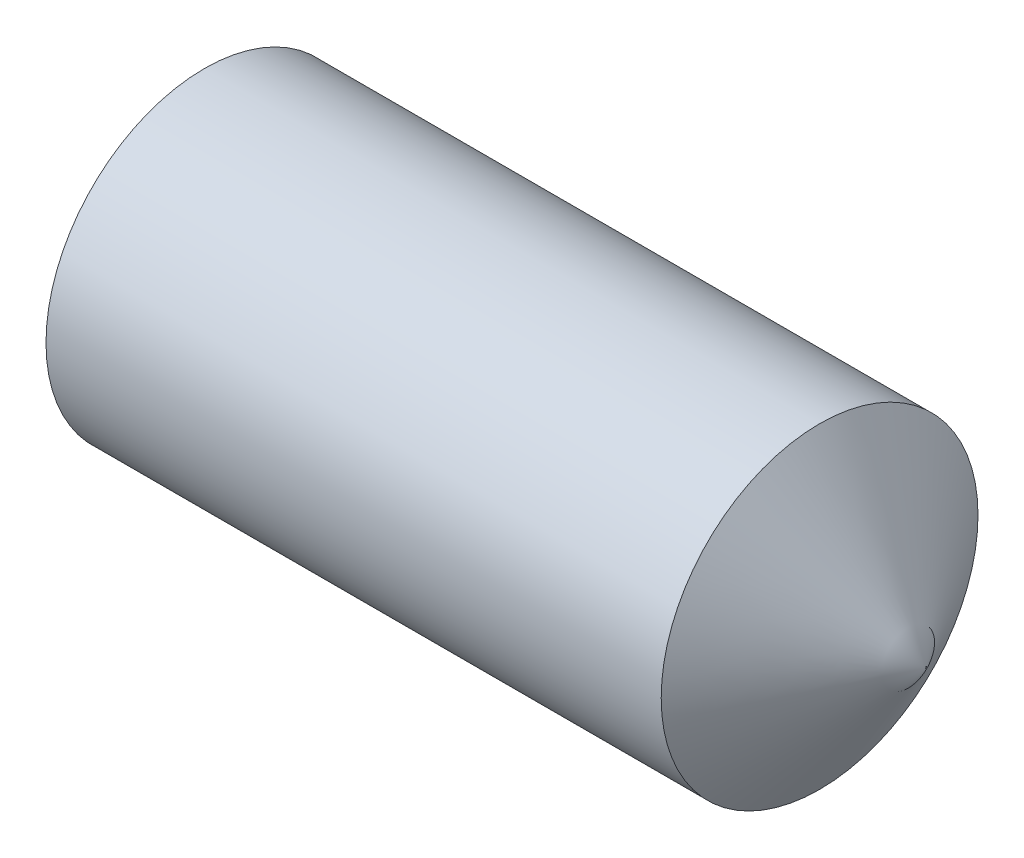
from build123d import *


with BuildPart() as part:
    # Sketch1 → Revolve1 (revolve)
    with BuildSketch(Plane(origin=(0, 0, 0), x_dir=(1, 0, 0), z_dir=(0, 1, 0)), mode=Mode.PRIVATE) as revolve1_sk:
        Polygon((0, 0), (0, 21.024390212), (81.656018759, 21.024390212), (95.762706385, 0), align=None)
    revolve(revolve1_sk.sketch.rotate(Axis((0, 0, 0), (1, 0, 0)), 180), axis=Axis((0, 0, 0), (1, 0, 0)))


solid = part.part
